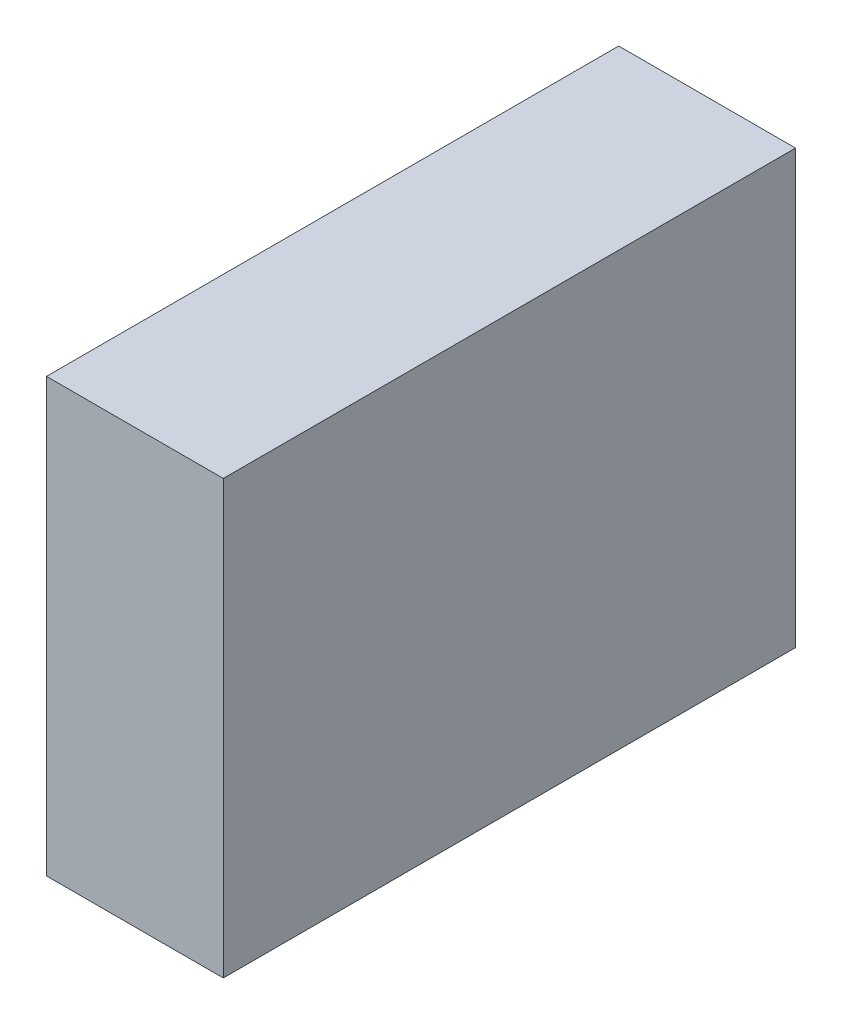
from build123d import *

# Parameters (mm, degrees)
SKETCH1_W           = 613
SKETCH1_H           = 1984
BOSS_EXTRUDE1_DEPTH = 1500


with BuildPart() as part:
    # Sketch1 → Boss-Extrude1 (new body)
    with BuildSketch(Plane(origin=(0, 0, 0), x_dir=(1, 0, 0), z_dir=(0, 1, 0))):
        with Locations((306.5, 992)):
            Rectangle(SKETCH1_W, SKETCH1_H)
    extrude(amount=BOSS_EXTRUDE1_DEPTH)


solid = part.part
